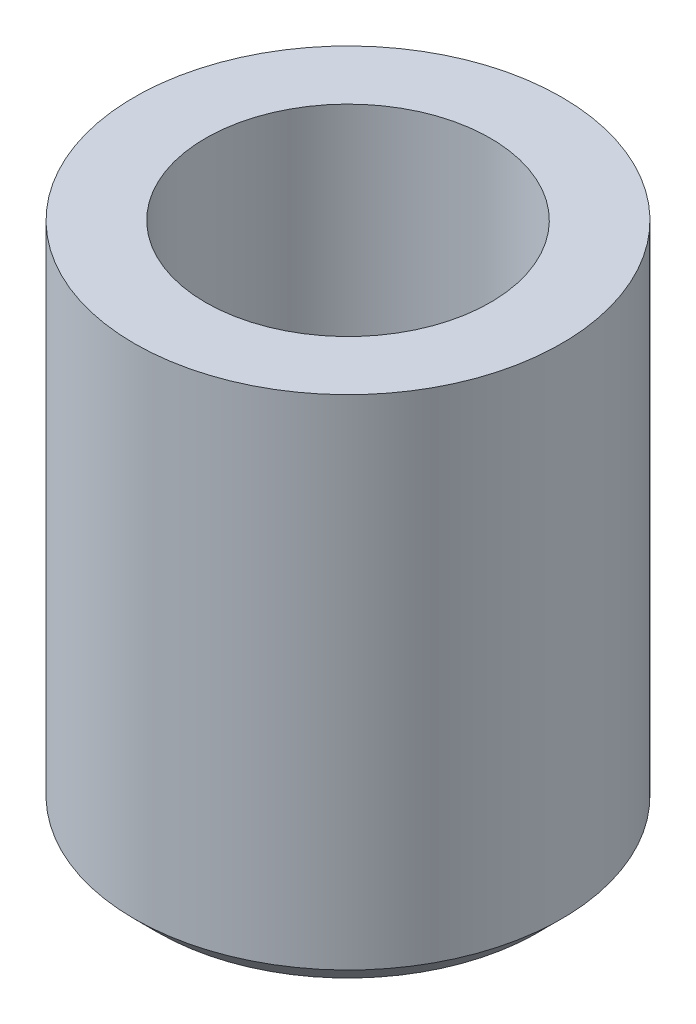
from build123d import *

# Parameters (mm, degrees)
SKETCH_1_R          = 4.5
EXTRUDE_1_DEPTH     = 11
SKETCH_2_R          = 3
CUT_EXTRUDE_1_DEPTH = 8
CHAMFER_1_SIZE      = 0.5


with BuildPart() as part:
    # 草图1 → 凸台-拉伸1 (new body)
    with BuildSketch(Plane(origin=(0, 0, 0), x_dir=(1, 0, 0), z_dir=(0, 1, 0))):
        with Locations(Location((0, 0, 0), (0, 0, 270))):
            Circle(SKETCH_1_R)
    extrude(amount=EXTRUDE_1_DEPTH)

    # 草图2 → 切除-拉伸1 (cut)
    with BuildSketch(Plane(origin=(0, 11, 0), x_dir=(1, 0, 0), z_dir=(0, 1, 0))):
        with Locations(Location((0, 0, 0), (0, 0, 270))):
            Circle(SKETCH_2_R)
    extrude(amount=-CUT_EXTRUDE_1_DEPTH, mode=Mode.SUBTRACT)

    # 倒角1
    chamfer_1_edges = [part.edges().sort_by_distance(p)[0] for p in [
        (0, 0, -4.5),
    ]]
    chamfer(chamfer_1_edges, length=CHAMFER_1_SIZE)


solid = part.part
